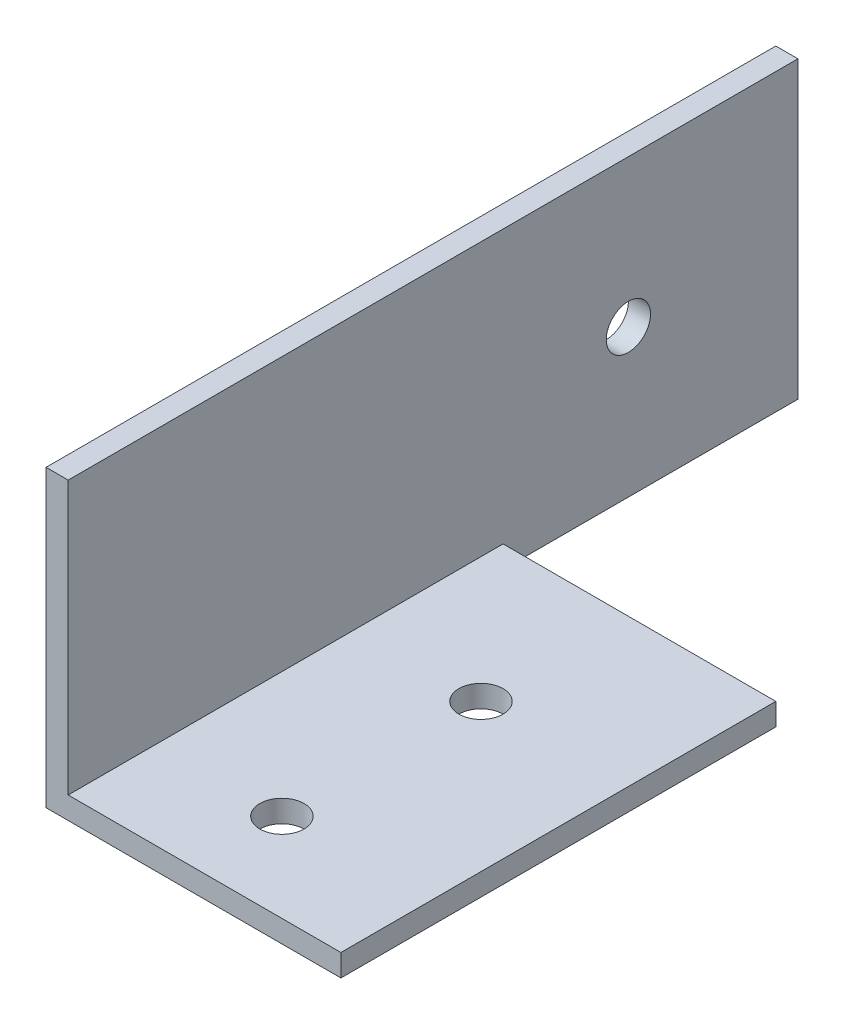
from build123d import *

# Parameters (mm, degrees)
EXTRUSION1_DEPTH = 49.5
ESQUISSE2_R      = 1.5
ESQUISSE2_W      = 18.5
ESQUISSE2_H      = 20
EXTRUSION2_DEPTH = 100
ESQUISSE3_R      = 1.5
EXTRUSION3_DEPTH = 100


with BuildPart() as part:
    # Esquisse1 → Extrusion1 (new body)
    with BuildSketch(Plane.XY):
        Polygon((-24.93137059, 6.591473684), (-24.93137059, -13.408526316), (-4.93137059, -13.408526316), (-4.93137059, -11.908526316), (-23.43137059, -11.908526316), (-23.43137059, 6.591473684), align=None)
    extrude(amount=EXTRUSION1_DEPTH)

    # Esquisse2 → Extrusion2 (cut)
    with BuildSketch(Plane(origin=(0, -11.908526316, 0), x_dir=(-1, 0, 0), z_dir=(0, 1, 0))):
        with Locations((14.93137059, 43.5)):
            Circle(ESQUISSE2_R)
        with Locations((14.93137059, 30)):
            Circle(ESQUISSE2_R)
        with Locations((14.18137059, 10)):
            Rectangle(ESQUISSE2_W, ESQUISSE2_H)
    extrude(amount=-EXTRUSION2_DEPTH, mode=Mode.SUBTRACT)

    # Esquisse3 → Extrusion3 (cut)
    with BuildSketch(Plane(origin=(-23.43137059, 0, 0), x_dir=(0, 0, -1), z_dir=(1, 0, 0))):
        with Locations((-11.5, -3.408526316)):
            Circle(ESQUISSE3_R)
    extrude(amount=-EXTRUSION3_DEPTH, mode=Mode.SUBTRACT)


solid = part.part
